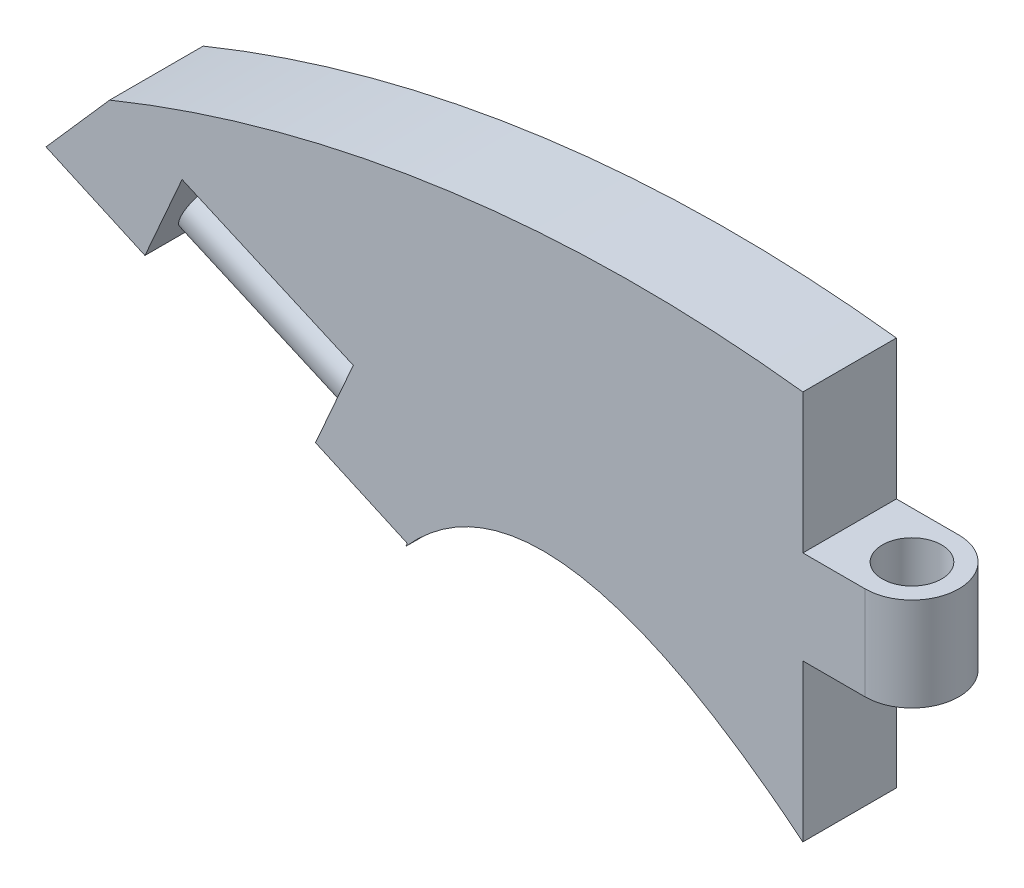
from build123d import *

# Parameters (mm, degrees)
SALIENTE_EXTRUIR1_DEPTH = 6
CORTAR_EXTRUIR2_DEPTH   = 10
SALIENTE_EXTRUIR2_REACH = 33.971
CROQUIS3_R              = 1.5
SALIENTE_EXTRUIR3_START = 10
SALIENTE_EXTRUIR3_DEPTH = 6
CROQUIS5_R              = 1.9
CORTAR_EXTRUIR3_DEPTH   = 6
CORTAR_EXTRUIR4_DEPTH   = 10
CORTAR_EXTRUIR8_DEPTH   = 10


with BuildPart() as part:
    # Croquis1 → Saliente-Extruir1 (new body)
    with BuildSketch(Plane.XY):
        with BuildLine():
            Line((-26.569033706, 2.264395111), (-54.029300138, 14.344700052))
            ThreePointArc((-54.029300138, 14.344700052), (-27.848836662, 23.896462082), (0, 24.942942963))
            Line((0, 24.942942963), (0, -0.057057037))
            add(Edge.make_bspline(
                [(-26.569033706, 2.264395111), (-17.747364857, 14.365738672), (0, -0.057057037)],
                knots=[0, 0, 0, 1, 1, 1], degree=2))
        make_face()
    extrude(amount=SALIENTE_EXTRUIR1_DEPTH)

    # Croquis2 → Cortar-Extruir2 (cut)
    with BuildSketch(Plane.XY.offset(6)):
        Polygon((-43.045193565, 9.512578075), (-39.823778914, 16.835315791), (-28.839672341, 12.003193814), (-32.061086993, 4.680456099), align=None)
    extrude(amount=-CORTAR_EXTRUIR2_DEPTH, mode=Mode.SUBTRACT)

    # Croquis3 → Saliente-Extruir2 (add, up to next)
    with BuildSketch(Plane(origin=(-28.587581395, 12.576232705, 0), x_dir=(0, 0, 1), z_dir=(-0.915342214401337, 0.4026768313857366, 0)), mode=Mode.PRIVATE) as saliente_extruir2_sk1:
        with Locations(Location((3, -4.626037871, 0), (0, 0, 90))):
            Circle(CROQUIS3_R)
    saliente_extruir2_tool1 = extrude(saliente_extruir2_sk1.sketch, amount=SALIENTE_EXTRUIR2_REACH, mode=Mode.PRIVATE) - part.part
    add(saliente_extruir2_tool1.solids().sort_by_distance((-30.45038, 8.341825, 3))[0])

    # Croquis4 → Saliente-Extruir3 (add)
    with BuildSketch(Plane(origin=(0, 0, 0), x_dir=(1, 0, 0), z_dir=(0, 1, 0)).offset(SALIENTE_EXTRUIR3_START)):
        with BuildLine():
            Line((0, 0), (4, 0))
            ThreePointArc((4, 0), (7, -3), (4, -6))
            Line((4, -6), (0, -6))
            Line((0, -6), (0, 0))
        make_face()
    extrude(amount=SALIENTE_EXTRUIR3_DEPTH)

    # Croquis5 → Cortar-Extruir3 (cut)
    with BuildSketch(Plane(origin=(0, 16, 0), x_dir=(1, 0, 0), z_dir=(0, 1, 0))):
        with Locations(Location((4, -3, 0), (0, 0, 270))):
            Circle(CROQUIS5_R)
    extrude(amount=-CORTAR_EXTRUIR3_DEPTH, mode=Mode.SUBTRACT)

    # Croquis6 → Cortar-Extruir4 (cut)
    with BuildSketch(Plane.XY.offset(6)):
        Polygon((-54.217314507, 14.240228789), (-26.345009663, 1.686933832), (-25.374680505, 3.841372979), (-53.24698535, 16.394667936), align=None)
    extrude(amount=-CORTAR_EXTRUIR4_DEPTH, mode=Mode.SUBTRACT)

    # Croquis7 → Cortar-Extruir8 (cut)
    with BuildSketch(Plane.XY.offset(6)):
        with BuildLine():
            Line((-44.469656668, 18.924767513), (-48.553751341, 14.280901201))
            ThreePointArc((-48.553751341, 14.280901201), (-47.473480209, 17.448678059), (-44.469656668, 18.924767513))
        make_face()
    extrude(amount=-CORTAR_EXTRUIR8_DEPTH, mode=Mode.SUBTRACT)


with BuildPart() as body_2:
    # of the pieces the cut leaves, the one that is kept (cortar_extruir8_keep)
    add(part.part.solids().sort_by_distance((0, 24.942942963, 0))[0])


solid = body_2.part
